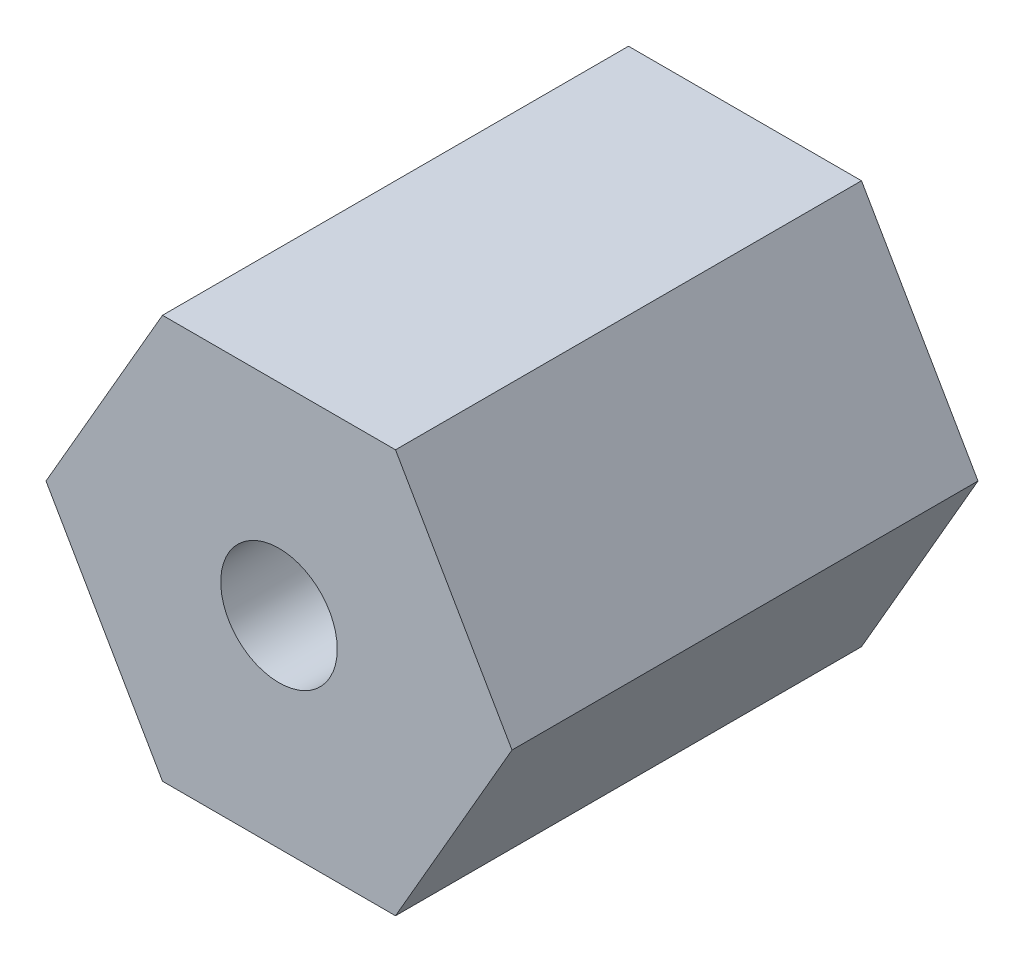
from build123d import *

# Parameters (mm, degrees)
BOSS_EXTRUDE1_DEPTH = 12
SKETCH3_R           = 3
CUT_EXTRUDE1_DEPTH  = 5
BOSS_EXTRUDE2_DEPTH = 12
SKETCH5_R           = 2
CUT_EXTRUDE2_DEPTH  = 5


with BuildPart() as part:
    # Sketch1 → Boss-Extrude1 (new body)
    with BuildSketch(Plane.XY):
        Polygon((12, 0), (6, 10.392304845), (-6, 10.392304845), (-12, 0), (-6, -10.392304845), (6, -10.392304845), align=None)
    extrude(amount=BOSS_EXTRUDE1_DEPTH)

    # Sketch3 → Cut-Extrude1 (cut)
    with BuildSketch(Plane.XY.offset(12)):
        Circle(SKETCH3_R)
    extrude(amount=-CUT_EXTRUDE1_DEPTH, mode=Mode.SUBTRACT)

    # Sketch4 → Boss-Extrude2 (add)
    with BuildSketch(Plane(origin=(0, 0, 0), x_dir=(-1, 0, 0), z_dir=(0, 0, -1))):
        Polygon((12, 0), (6, 10.392304845), (-6, 10.392304845), (-12, 0), (-6, -10.392304845), (6, -10.392304845), align=None)
    extrude(amount=BOSS_EXTRUDE2_DEPTH)

    # Sketch5 → Cut-Extrude2 (cut)
    with BuildSketch(Plane(origin=(0, 0, -12), x_dir=(-1, 0, 0), z_dir=(0, 0, -1))):
        Circle(SKETCH5_R)
    extrude(amount=-CUT_EXTRUDE2_DEPTH, mode=Mode.SUBTRACT)


solid = part.part
